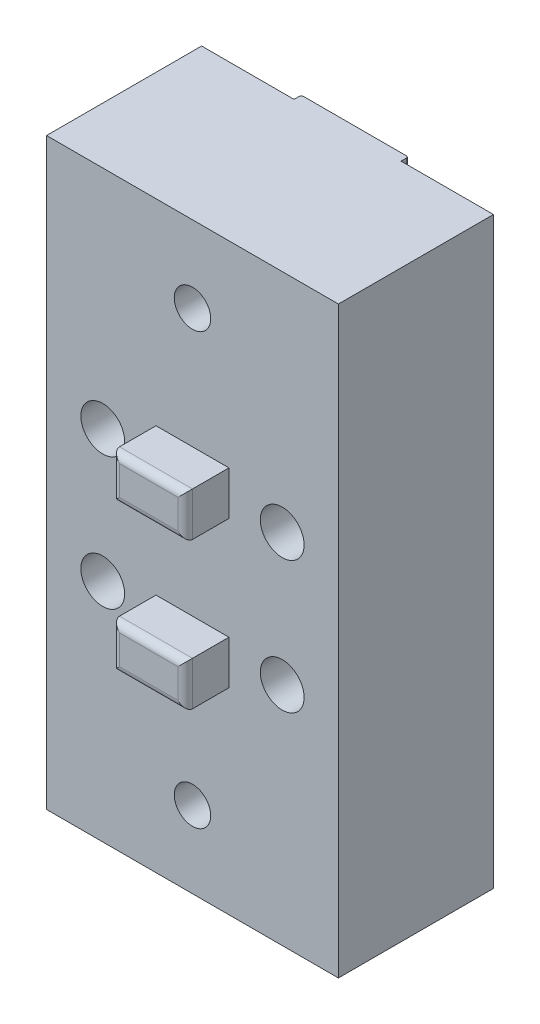
from build123d import *

# Parameters (mm, degrees)
SKETCH1_W           = 40
SKETCH1_H           = 80
SKETCH1_R           = 2
BOSS_EXTRUDE1_DEPTH = 21.25
SKETCH4_W           = 14.67
SKETCH4_H           = 80
BOSS_EXTRUDE3_DEPTH = 1
FILLET1_R           = 0.25
FILLET2_R           = 0.25
SKETCH2_W           = 10
SKETCH2_H           = 6
BOSS_EXTRUDE4_DEPTH = 6
SKETCH5_R           = 2.5
CUT_EXTRUDE1_DEPTH  = 53.896715399
SKETCH6_R           = 3
CUT_EXTRUDE2_DEPTH  = 6
FILLET3_R           = 1


with BuildPart() as part:
    # Sketch1 → Boss-Extrude1 (new body)
    with BuildSketch(Plane.XY):
        Rectangle(SKETCH1_W, SKETCH1_H)
        with Locations((12.3, 9.05)):
            Circle(SKETCH1_R, mode=Mode.SUBTRACT)
        with Locations((12.3, -9.05)):
            Circle(SKETCH1_R, mode=Mode.SUBTRACT)
        with Locations((-12.3, 9.05)):
            Circle(SKETCH1_R, mode=Mode.SUBTRACT)
        with Locations((-12.3, -9.05)):
            Circle(SKETCH1_R, mode=Mode.SUBTRACT)
    extrude(amount=BOSS_EXTRUDE1_DEPTH)

    # Sketch4 → Boss-Extrude3 (add)
    with BuildSketch(Plane(origin=(0, 0, 0), x_dir=(-1, 0, 0), z_dir=(0, 0, -1))):
        Rectangle(SKETCH4_W, SKETCH4_H)
    extrude(amount=BOSS_EXTRUDE3_DEPTH)

    # Fillet1
    fillet1_edges = [part.edges().sort_by_distance(p)[0] for p in [
        (7.335, 0, -1),
    ]]
    fillet(fillet1_edges, radius=FILLET1_R)

    # Fillet2
    fillet2_edges = [part.edges().sort_by_distance(p)[0] for p in [
        (-7.335, 0, -1),
    ]]
    fillet(fillet2_edges, radius=FILLET2_R)

    # Sketch2 → Boss-Extrude4 (add)
    with BuildSketch(Plane.XY.offset(21.25)):
        Polygon((-5, -13.05), (0, -13.05), (5, -13.05), (5, -7.05), (-5, -7.05), align=None)
        with Locations((0, 10.05)):
            Rectangle(SKETCH2_W, SKETCH2_H)
    extrude(amount=BOSS_EXTRUDE4_DEPTH)

    # Sketch5 → Cut-Extrude1 (cut, through all)
    with BuildSketch(Plane(origin=(0, 0, -1), x_dir=(-1, 0, 0), z_dir=(0, 0, -1))):
        with Locations((0, 29.5)):
            Circle(SKETCH5_R)
        with Locations(Location((0, -29.5, 0), (0, 0, 180))):
            Circle(SKETCH5_R)
    extrude(amount=-CUT_EXTRUDE1_DEPTH, mode=Mode.SUBTRACT)

    # Sketch6 → Cut-Extrude2 (cut)
    with BuildSketch(Plane.XY.offset(21.25)):
        with Locations((-12.3, 9.05)):
            Circle(SKETCH6_R)
        with Locations((12.3, 9.05)):
            Circle(SKETCH6_R)
        with Locations((12.3, -9.05)):
            Circle(SKETCH6_R)
        with Locations((-12.3, -9.05)):
            Circle(SKETCH6_R)
    extrude(amount=-CUT_EXTRUDE2_DEPTH, mode=Mode.SUBTRACT)

    # Fillet3
    fillet3_edges = [part.edges().sort_by_distance(p)[0] for p in [
        (5, -10.05, 27.25),
        (0, -7.05, 27.25),
        (-5, -10.05, 27.25),
        (0, -13.05, 27.25),
        (0, 13.05, 27.25),
        (-5, 10.05, 27.25),
        (0, 7.05, 27.25),
        (5, 10.05, 27.25),
    ]]
    fillet(fillet3_edges, radius=FILLET3_R)


solid = part.part
